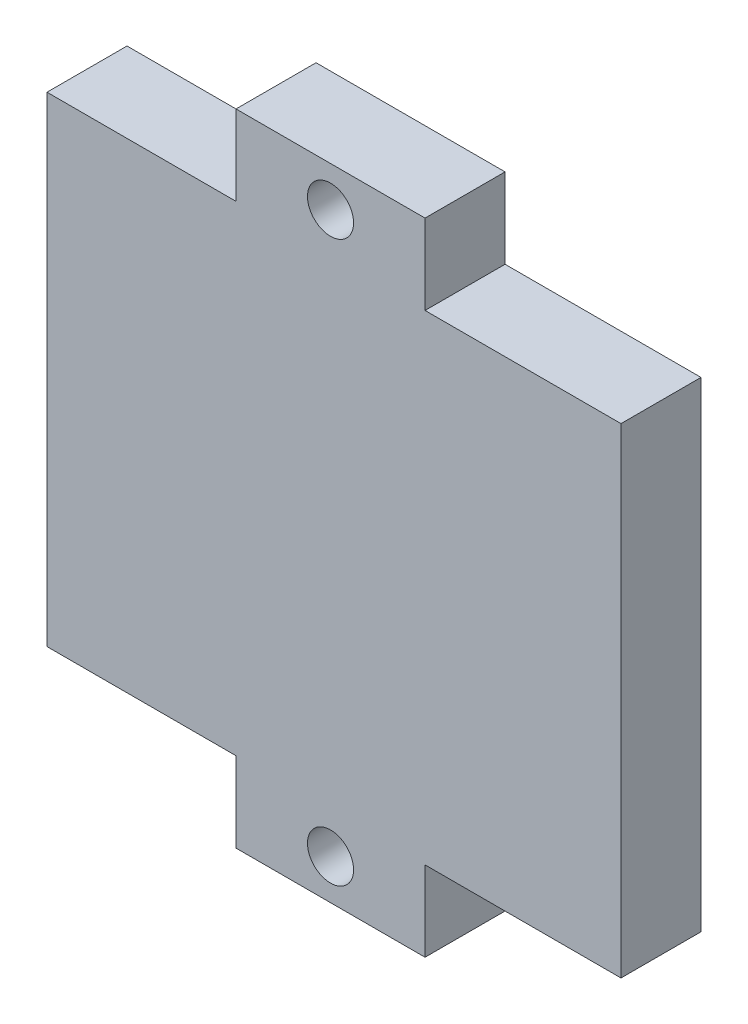
from build123d import *

# Parameters (mm, degrees)
SKETCH1_W             = 45.55
SKETCH1_H             = 50.8
BOSS_EXTRUDE1_DEPTH   = 6.35
SKETCH2_W             = 15
SKETCH2_H             = 6.35
SKETCH2_W_2           = 15.55
CUT_EXTRUDE1_DEPTH    = 6.35
F_6_CLEARANCE_HOLE1_D = 3.6576


with BuildPart() as part:
    # Sketch1 → Boss-Extrude1 (new body)
    with BuildSketch(Plane.XY):
        Rectangle(SKETCH1_W, SKETCH1_H)
    extrude(amount=BOSS_EXTRUDE1_DEPTH)

    # Sketch2 → Cut-Extrude1 (cut)
    with BuildSketch(Plane.XY.offset(6.35)):
        with Locations((-15.275, -22.225)):
            Rectangle(SKETCH2_W, SKETCH2_H)
        with Locations((15, -22.225)):
            Rectangle(SKETCH2_W_2, SKETCH2_H)
    cut_extrude1 = extrude(amount=-CUT_EXTRUDE1_DEPTH, mode=Mode.SUBTRACT)

    # #6 Clearance Hole1 (through all)
    with Locations(Plane.XY.offset(6.35)):
        with Locations((-0.275, -22.225)):
            f_6_clearance_hole1 = Hole(F_6_CLEARANCE_HOLE1_D / 2)

    # Mirror1: Cut-Extrude1, #6 Clearance Hole1 across plane
    add(cut_extrude1.mirror(Plane.ZX), mode=Mode.SUBTRACT)
    add(f_6_clearance_hole1.mirror(Plane.ZX), mode=Mode.SUBTRACT)


solid = part.part
